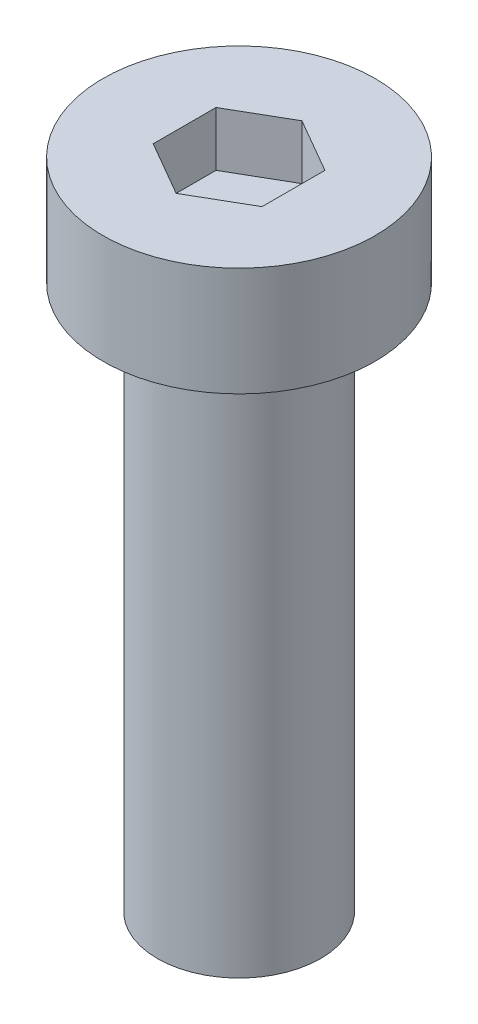
from build123d import *

# Parameters (mm, degrees)
CUT_EXTRUDE1_DEPTH = 2


with BuildPart() as part:
    # Sketch1 → Revolve1 (revolve)
    with BuildSketch(Plane.XY, mode=Mode.PRIVATE) as revolve1_sk:
        Polygon((0, 0), (0, 24), (5, 24), (5, 20), (3, 20), (3, 0), align=None)
    revolve(revolve1_sk.sketch.rotate(Axis((0, 0, 0), (0, 1, 0)), 90), axis=Axis((0, 0, 0), (0, 1, 0)))

    # Sketch2 → Cut-Extrude1 (cut)
    with BuildSketch(Plane(origin=(0, 24, 0), x_dir=(1, 0, 0), z_dir=(0, 1, 0))):
        Polygon((0, -2.309401077), (2, -1.154700538), (2, 1.154700538), (0, 2.309401077), (-2, 1.154700538), (-2, -1.154700538), align=None)
    extrude(amount=-CUT_EXTRUDE1_DEPTH, mode=Mode.SUBTRACT)


solid = part.part
